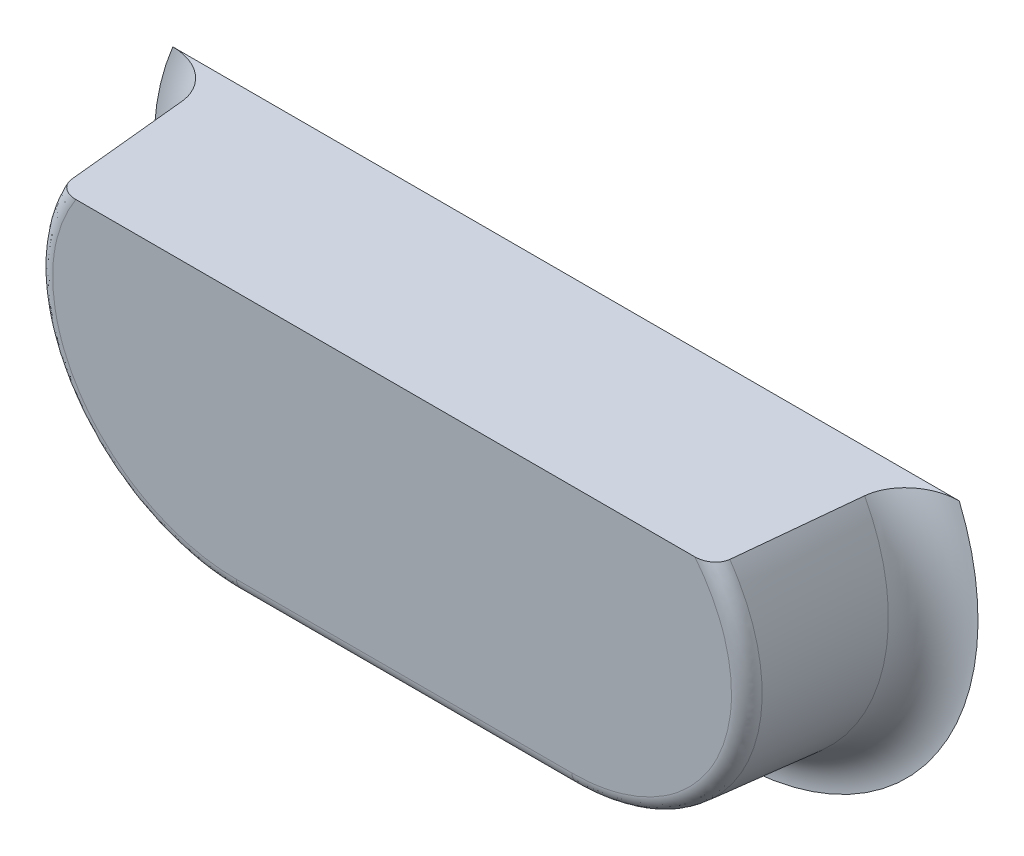
from build123d import *

# Parameters (mm, degrees)
BOSS_EXTRUDE1_DEPTH = 12
BOSS_EXTRUDE1_TAPER = 5
SKETCH2_W           = 65.663584352
SKETCH2_H           = 13.360489219
CUT_EXTRUDE1_DEPTH  = 74.667326552
SKETCH3_W           = 72.132604944
SKETCH3_H           = 37.201111507
BOSS_EXTRUDE2_DEPTH = 10
FILLET1_R           = 3.5
SKETCH4_W           = 81.250289089
SKETCH4_H           = 16.618597718
CUT_EXTRUDE2_DEPTH  = 79.90066452
DRAFT2_ANGLE        = -4
FILLET3_R           = 1.2


with BuildPart() as part:
    # Sketch1 → Boss-Extrude1 (new body)
    with BuildSketch(Plane.XY):
        with BuildLine():
            Line((21.450148661, 8.816932272), (46.450148661, 8.816932272))
            ThreePointArc((46.450148661, 8.816932272), (61.450148661, 23.816932272), (46.450148661, 38.816932272))
            Line((46.450148661, 38.816932272), (21.450148661, 38.816932272))
            ThreePointArc((21.450148661, 38.816932272), (6.450148661, 23.816932272), (21.450148661, 8.816932272))
        make_face()
    extrude(amount=BOSS_EXTRUDE1_DEPTH, taper=BOSS_EXTRUDE1_TAPER)

    # Sketch2 → Cut-Extrude1 (cut, through all)
    with BuildSketch(Plane(origin=(0, 0, 0), x_dir=(-1, 0, 0), z_dir=(0, 0, -1))):
        with Locations((-32.000877842, 37.497176882)):
            Rectangle(SKETCH2_W, SKETCH2_H)
    extrude(amount=-CUT_EXTRUDE1_DEPTH, mode=Mode.SUBTRACT)

    # Sketch3 → Boss-Extrude2 (add)
    with BuildSketch(Plane(origin=(0, 0, 0), x_dir=(-1, 0, 0), z_dir=(0, 0, -1))):
        with Locations((-32.471221279, 19.407226217)):
            Rectangle(SKETCH3_W, SKETCH3_H)
    extrude(amount=BOSS_EXTRUDE2_DEPTH)

    # Fillet1
    fillet1_edges = [part.edges().sort_by_distance(p)[0] for p in [
        (59.295381239, 16.070965579, 0),
        (33.950148661, 8.816932272, 0),
        (8.604916082, 16.070965579, 0),
    ]]
    fillet(fillet1_edges, radius=FILLET1_R)

    # Sketch4 → Cut-Extrude2 (cut, through all)
    with BuildSketch(Plane.XZ.offset(-0.806670463)):
        with Locations((37.030063352, -8.309298859)):
            Rectangle(SKETCH4_W, SKETCH4_H)
    extrude(amount=-CUT_EXTRUDE2_DEPTH, mode=Mode.SUBTRACT)

    # Draft2
    draft2_faces = [part.faces().sort_by_distance(p)[0] for p in [
        (33.950148661, 20.873226907, 12),
    ]]
    draft(draft2_faces, Plane.ZX.offset(9.866796234), DRAFT2_ANGLE)

    # Fillet3
    fillet3_edges = [part.edges().sort_by_distance(p)[0] for p in [
        (58.506945165, 16.885570637, 12.490800518),
        (33.950148661, 9.866796234, 12),
        (9.393352156, 16.885570637, 12.490800518),
    ]]
    fillet(fillet3_edges, radius=FILLET3_R)


solid = part.part
